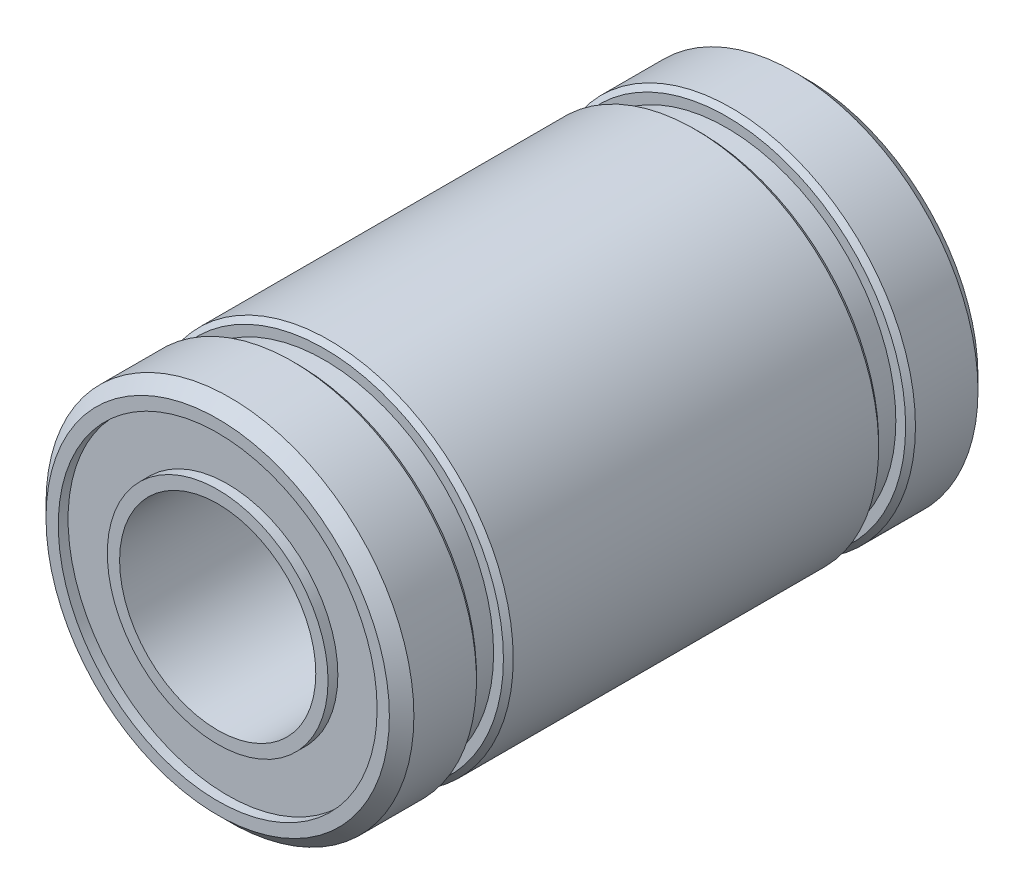
from build123d import *

# Parameters (mm, degrees)
SKETCH1_R           = 7.5
SKETCH1_R_2         = 4
BOSS_EXTRUDE1_DEPTH = 24
SKETCH2_R           = 6.5
SKETCH2_R_2         = 4.5
CUT_EXTRUDE1_DEPTH  = 0.4
SKETCH3_W           = 1.1
SKETCH3_H           = 0.6
CHAMFER1_SIZE       = 0.5
CHAMFER2_SIZE       = 0.2


with BuildPart() as part:
    # Sketch1 → Boss-Extrude1 (new body)
    with BuildSketch(Plane.XY):
        Circle(SKETCH1_R)
        Circle(SKETCH1_R_2, mode=Mode.SUBTRACT)
    extrude(amount=BOSS_EXTRUDE1_DEPTH)

    # Sketch2 → Cut-Extrude1 (cut)
    with BuildSketch(Plane.XY.offset(24)):
        Circle(SKETCH2_R)
        Circle(SKETCH2_R_2, mode=Mode.SUBTRACT)
    cut_extrude1 = extrude(amount=-CUT_EXTRUDE1_DEPTH, mode=Mode.SUBTRACT)

    # Mirror1: Cut-Extrude1 across plane
    add(cut_extrude1.mirror(Plane.XY.offset(12)), mode=Mode.SUBTRACT)

    # Sketch3 → Cut-Revolve1 (revolve, cut)
    with BuildSketch(Plane(origin=(0, 0, 0), x_dir=(0, 0, -1), z_dir=(1, 0, 0)), mode=Mode.PRIVATE) as cut_revolve1_sk:
        with Locations((-20.2, 7.2)):
            Rectangle(SKETCH3_W, SKETCH3_H)
        with Locations((-3.8, 7.2)):
            Rectangle(SKETCH3_W, SKETCH3_H)
    revolve(cut_revolve1_sk.sketch.rotate(Axis((0, 0, 24), (0, 0, -1)), 90), axis=Axis((0, 0, 24), (0, 0, -1)), mode=Mode.SUBTRACT)

    # Chamfer1
    chamfer1_edges = [part.edges().sort_by_distance(p)[0] for p in [
        (-7.5, 0, 0),
        (-7.5, 0, 24),
    ]]
    chamfer(chamfer1_edges, length=CHAMFER1_SIZE)

    # Chamfer2
    chamfer2_edges = [part.edges().sort_by_distance(p)[0] for p in [
        (-7.5, 0, 20.75),
        (-7.5, 0, 19.65),
        (-7.5, 0, 4.35),
        (-7.5, 0, 3.25),
    ]]
    chamfer(chamfer2_edges, length=CHAMFER2_SIZE)


solid = part.part
